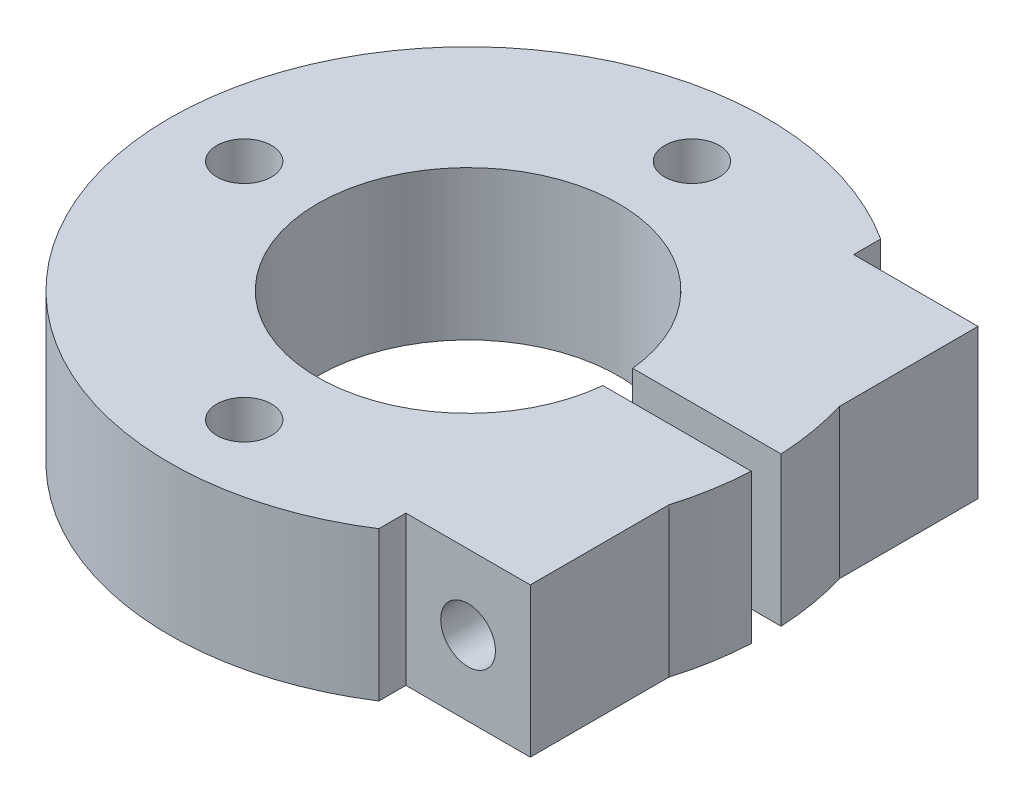
from build123d import *

# Parameters (mm, degrees)
MAIN_PROFILE_SKETCH_R          = 1.1
MAIN_EXTRUSION_DEPTH           = 4
DETAIL_PROFILE_2_SKETCH_R      = 2
DETAIL_EXTRUSION_2_DEPTH       = 2
CROSS_BOLT_CLEARANCE_PROFILE_R = 1.1
CROSS_BOLT_CLEARANCE_DEPTH     = 24


with BuildPart() as part:
    # Main Profile Sketch → Main Extrusion (new body)
    with BuildSketch(Plane(origin=(0, -157, 0), x_dir=(-1, 0, 0), z_dir=(0, -1, 0))):
        with BuildLine():
            Line((44.791651246, -3.4278273), (44.791651246, -9))
            Line((44.791651246, -9), (49.791651246, -9))
            Line((49.791651246, -9), (49.791651246, -10.087120501))
            ThreePointArc((49.791651246, -10.087120501), (68.291651246, 0), (49.791651246, 10.087120501))
            Line((49.791651246, 10.087120501), (49.791651246, 9))
            Line((49.791651246, 9), (44.791651246, 9))
            Line((44.791651246, 9), (44.791651246, 3.4278273))
            ThreePointArc((44.791651246, 3.4278273), (44.46433761, 2.02846054), (44.306660633, 0.6))
            Line((44.306660633, 0.6), (50.27147683, 0.6))
            ThreePointArc((50.27147683, 0.6), (62.341651246, 0), (50.27147683, -0.6))
            Line((50.27147683, -0.6), (44.306660633, -0.6))
            ThreePointArc((44.306660633, -0.6), (44.46433761, -2.02846054), (44.791651246, -3.4278273))
        make_face()
        with Locations(Location((65.291651246, 0, 0), (0, 0, 90))):
            Circle(MAIN_PROFILE_SKETCH_R, mode=Mode.SUBTRACT)
        with Locations(Location((56.291651246, 9, 0), (0, 0, 90))):
            Circle(MAIN_PROFILE_SKETCH_R, mode=Mode.SUBTRACT)
        with Locations(Location((56.291651246, -9, 0), (0, 0, 90))):
            Circle(MAIN_PROFILE_SKETCH_R, mode=Mode.SUBTRACT)
    extrude(amount=MAIN_EXTRUSION_DEPTH)

    # Detail Profile 2 Sketch → Detail Extrusion 2 (add)
    with BuildSketch(Plane(origin=(0, -161, 0), x_dir=(-1, 0, 0), z_dir=(0, -1, 0))):
        with BuildLine():
            Line((44.791651246, -3.4278273), (44.791651246, -9))
            Line((44.791651246, -9), (49.791651246, -9))
            Line((49.791651246, -9), (49.791651246, -10.087120501))
            ThreePointArc((49.791651246, -10.087120501), (68.291651246, 0), (49.791651246, 10.087120501))
            Line((49.791651246, 10.087120501), (49.791651246, 9))
            Line((49.791651246, 9), (44.791651246, 9))
            Line((44.791651246, 9), (44.791651246, 3.4278273))
            ThreePointArc((44.791651246, 3.4278273), (44.46433761, 2.02846054), (44.306660633, 0.6))
            Line((44.306660633, 0.6), (50.27147683, 0.6))
            ThreePointArc((50.27147683, 0.6), (62.341651246, 0), (50.27147683, -0.6))
            Line((50.27147683, -0.6), (44.306660633, -0.6))
            ThreePointArc((44.306660633, -0.6), (44.46433761, -2.02846054), (44.791651246, -3.4278273))
        make_face()
        with Locations(Location((65.291651246, 0, 0), (0, 0, 90))):
            Circle(DETAIL_PROFILE_2_SKETCH_R, mode=Mode.SUBTRACT)
        with Locations(Location((56.291651246, 9, 0), (0, 0, 90))):
            Circle(DETAIL_PROFILE_2_SKETCH_R, mode=Mode.SUBTRACT)
        with Locations(Location((56.291651246, -9, 0), (0, 0, 90))):
            Circle(DETAIL_PROFILE_2_SKETCH_R, mode=Mode.SUBTRACT)
    extrude(amount=DETAIL_EXTRUSION_2_DEPTH)

    # Cross Bolt Clearance profile → Cross Bolt Clearance (cut)
    with BuildSketch(Plane.XY.offset(-12)):
        with Locations(Location((-47.291651246, -160, 0), (0, 0, 180))):
            Circle(CROSS_BOLT_CLEARANCE_PROFILE_R)
    extrude(amount=CROSS_BOLT_CLEARANCE_DEPTH, mode=Mode.SUBTRACT)


solid = part.part
